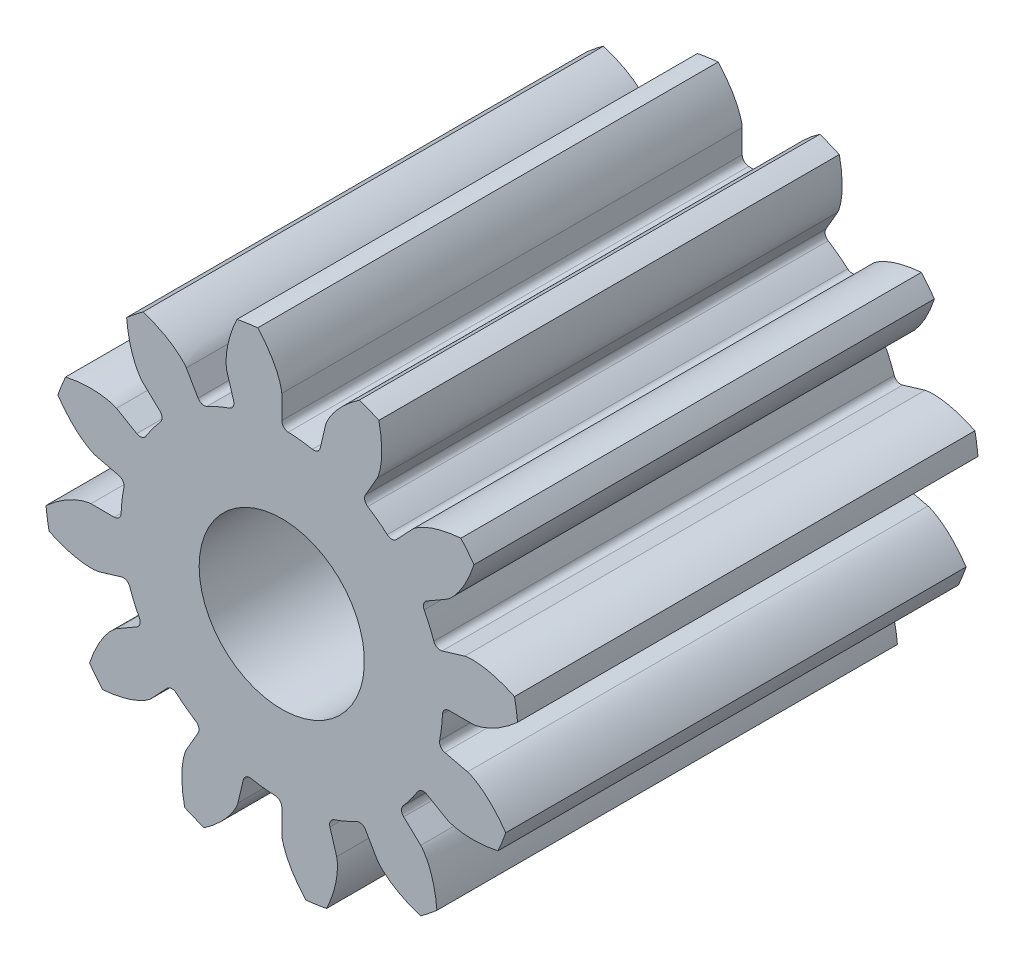
from build123d import *

# Parameters (mm, degrees)
SKETCH3_R           = 3.5
BOSS_EXTRUDE1_DEPTH = 6.8
CUT_EXTRUDE2_DEPTH  = 9.410707461
CIRPATTERN1_COUNT   = 12
FILLET1_R           = 0.1
SKETCH9_R           = 1.22
CUT_EXTRUDE3_DEPTH  = 9.395756067


with BuildPart() as part:
    # Sketch3 → Boss-Extrude1 (new body)
    with BuildSketch(Plane.XY):
        Circle(SKETCH3_R)
    extrude(amount=BOSS_EXTRUDE1_DEPTH)

    # Sketch4 → Cut-Extrude2 (cut, symmetric)
    with BuildSketch(Plane.XY):
        with BuildLine():
            Line((2.819077862, 0), (2.375, 0))
            ThreePointArc((2.375, 0), (2.359040199, -0.274871497), (2.311375293, -0.546048767))
            Line((2.311375293, -0.546048767), (2.743556598, -0.648149049))
            add(Edge.make_bspline(
                [(2.743556598, -0.648149049), (2.745574777, -0.648671151), (2.751199465, -0.650267301), (2.76168561, -0.653803575), (2.778548801, -0.660298841), (2.80931066, -0.673904903), (2.845172689, -0.692730032), (2.884490653, -0.716383629), (2.925456432, -0.744135526), (2.959634632, -0.769282013), (2.992899484, -0.79565793), (3.025261591, -0.823079288), (3.063505391, -0.857615597), (3.108004582, -0.900844194), (3.157932354, -0.953918259), (3.212014505, -1.017045522), (3.256224413, -1.073991589), (3.285838807, -1.114735907), (3.302609694, -1.138818269), (3.307228707, -1.145529695)],
                knots=[0, 0, 0, 0, 0, 0.005376748, 0.015083688, 0.02853182, 0.046610139, 0.092110525, 0.119476175, 0.146842495, 0.174208853, 0.201574955, 0.228941013, 0.256307345, 0.307035032, 0.361767351, 0.41649966, 0.471231936, 0.492236381, 0.492236381, 0.492236381, 0.492236381, 0.492236381], degree=4))
            ThreePointArc((3.307228707, -1.145529695), (3.451470735, -0.580818184), (3.5, 0))
            ThreePointArc((3.5, 0), (3.495498347, 0.177457902), (3.482004967, 0.354459316))
            add(Edge.make_bspline(
                [(2.819077862, 0), (2.821162016, 4.4104e-05), (2.827003, 0.000304293), (2.838021272, 0.001334908), (2.85592607, 0.003779065), (2.88899208, 0.009948008), (2.928221573, 0.020023596), (2.971924557, 0.034003729), (3.018173475, 0.051593512), (3.057217625, 0.068208251), (3.095655559, 0.086229476), (3.133455296, 0.105475692), (3.178614993, 0.130293962), (3.231860995, 0.162133449), (3.292653772, 0.202306537), (3.359801019, 0.251308349), (3.415919343, 0.296564335), (3.454108127, 0.329408338), (3.475966636, 0.348989667), (3.482004967, 0.354459316)],
                knots=[0, 0, 0, 0, 0, 0.005376748, 0.015083688, 0.02853182, 0.046610139, 0.092110525, 0.119476175, 0.146842495, 0.174208853, 0.201574955, 0.228941013, 0.256307345, 0.307035032, 0.361767351, 0.41649966, 0.471231936, 0.492236381, 0.492236381, 0.492236381, 0.492236381, 0.492236381], degree=4))
        make_face()
    cut_extrude2 = extrude(amount=CUT_EXTRUDE2_DEPTH, both=True, mode=Mode.SUBTRACT)

    # CirPattern1: Cut-Extrude2 ×12 about axis
    cirpattern1_axis = Axis((0, 0, 6.8), (0, 0, 1))
    for i in range(1, CIRPATTERN1_COUNT):
        add(cut_extrude2.rotate(cirpattern1_axis, i * 360 / CIRPATTERN1_COUNT), mode=Mode.SUBTRACT)

    # Fillet1
    fillet1_edges = [part.edges().sort_by_distance(p)[0] for p in [
        (-0.682795542, 2.274734105, 3.4),
        (-1.1875, 2.056810334, 3.4),
        (2.311375293, -0.546048767, 3.4),
        (-1.728685338, 1.628579751, 3.4),
        (-2.056810334, 1.1875, 3.4),
        (2.375, 0, 3.4),
        (-2.311375293, 0.546048767, 3.4),
        (-2.375, 0, 3.4),
        (-2.274734105, -0.682795542, 3.4),
        (-2.056810334, -1.1875, 3.4),
        (-1.628579751, -1.728685338, 3.4),
        (-1.1875, -2.056810334, 3.4),
        (-0.546048767, -2.311375293, 3.4),
        (0, -2.375, 3.4),
        (0.682795542, -2.274734105, 3.4),
        (1.1875, -2.056810334, 3.4),
        (1.728685338, -1.628579751, 3.4),
        (2.056810334, -1.1875, 3.4),
        (2.274734105, 0.682795542, 3.4),
        (2.056810334, 1.1875, 3.4),
        (1.628579751, 1.728685338, 3.4),
        (1.1875, 2.056810334, 3.4),
        (0.546048767, 2.311375293, 3.4),
        (0, 2.375, 3.4),
    ]]
    fillet(fillet1_edges, radius=FILLET1_R)

    # Sketch9 → Cut-Extrude3 (cut, through all)
    with BuildSketch(Plane(origin=(0, 0, 0), x_dir=(-1, 0, 0), z_dir=(0, 0, -1))):
        Circle(SKETCH9_R)
    extrude(amount=-CUT_EXTRUDE3_DEPTH, mode=Mode.SUBTRACT)


solid = part.part
